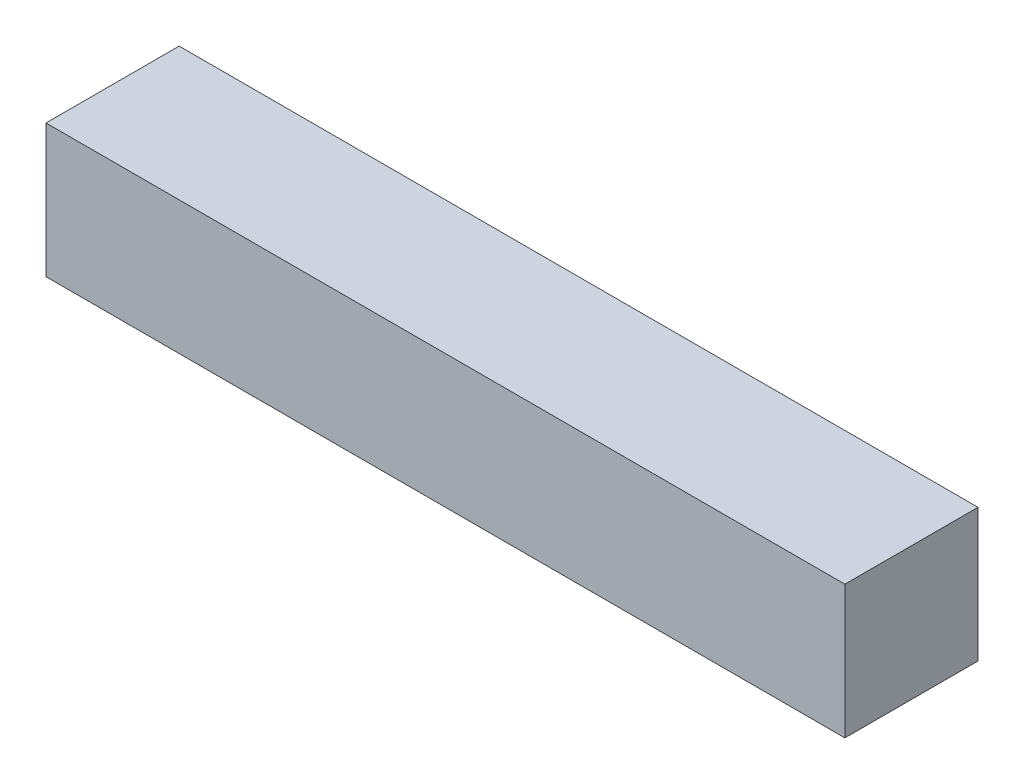
from build123d import *

# Parameters (mm, degrees)
SKETCH1_W           = 60
SKETCH1_H           = 10
BOSS_EXTRUDE1_DEPTH = 10


with BuildPart() as part:
    # Sketch1 → Boss-Extrude1 (new body)
    with BuildSketch(Plane.XY):
        with Locations((30, 5)):
            Rectangle(SKETCH1_W, SKETCH1_H)
    extrude(amount=BOSS_EXTRUDE1_DEPTH)


solid = part.part
